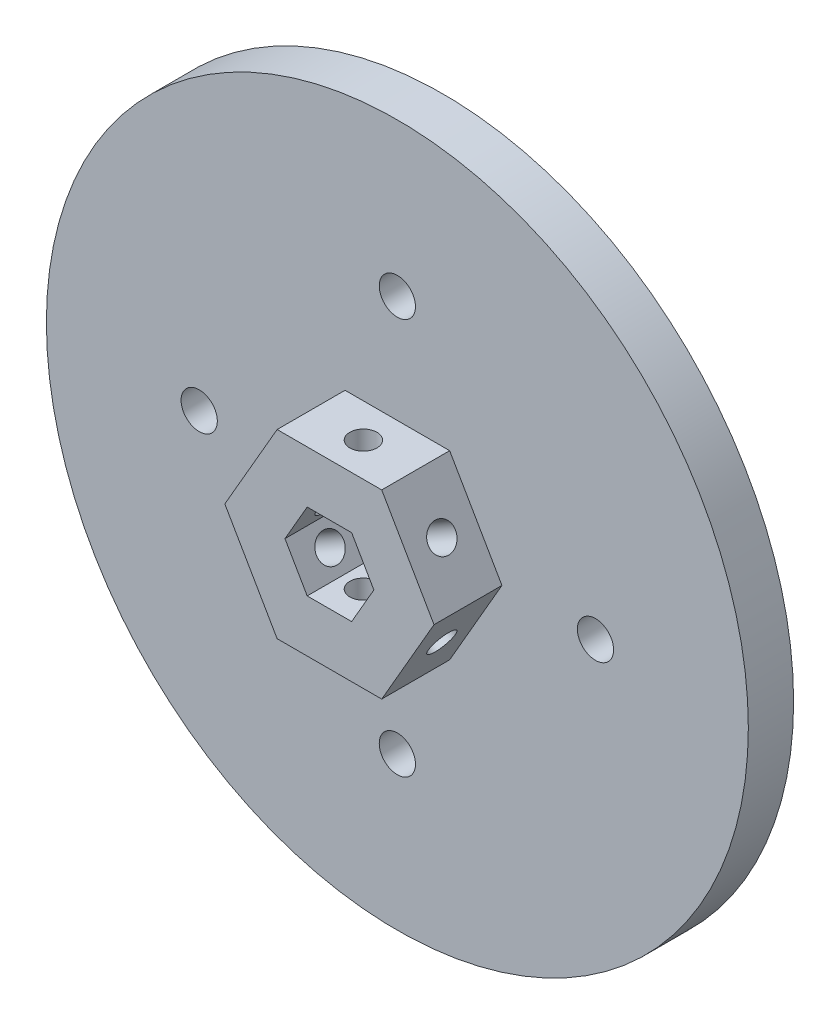
from build123d import *

# Parameters (mm, degrees)
SZKIC1_R                    = 31
DODANIE_WYCI_GNI_CIE1_DEPTH = 4
DODANIE_WYCI_GNI_CIE2_DEPTH = 6
SZKIC3_R                    = 1.2
WYTNIJ_WYCI_GNI_CIE1_DEPTH  = 51.813384064
SZYK_KO_OWY1_COUNT          = 3
SZKIC4_R                    = 1.6
WYTNIJ_WYCI_GNI_CIE2_DEPTH  = 6
WYTNIJ_WYCI_GNI_CIE3_DEPTH  = 45.24929378


with BuildPart() as part:
    # Szkic1 → Dodanie-wyciągnięcie1 (new body)
    with BuildSketch(Plane.XY):
        Circle(SZKIC1_R)
    extrude(amount=DODANIE_WYCI_GNI_CIE1_DEPTH)

    # Szkic2 → Dodanie-wyciągnięcie2 (add)
    with BuildSketch(Plane.XY.offset(4)):
        Polygon((4.618802154, 8), (-4.618802154, 8), (-9.237604307, 0), (-4.618802154, -8), (4.618802154, -8), (9.237604307, 0), align=None)
        Polygon((1.962990915, 3.4), (-1.962990915, 3.4), (-3.92598183, 0), (-1.962990915, -3.4), (1.962990915, -3.4), (3.92598183, 0), align=None, mode=Mode.SUBTRACT)
    extrude(amount=DODANIE_WYCI_GNI_CIE2_DEPTH)

    # Szkic3 → Wytnij-wyciągnięcie1 (cut, through all)
    with BuildSketch(Plane(origin=(0, 8, 0), x_dir=(1, 0, 0), z_dir=(0, 1, 0))):
        with Locations(Location((0, -7, 0), (0, 0, 180))):
            Circle(SZKIC3_R)
    wytnij_wyci_gni_cie1 = extrude(amount=-WYTNIJ_WYCI_GNI_CIE1_DEPTH, mode=Mode.SUBTRACT)

    # Szyk kołowy1: Wytnij-wyciągnięcie1 ×3 about axis
    szyk_ko_owy1_axis = Axis((0, 0, 4), (0, 0, 1))
    for i in range(1, SZYK_KO_OWY1_COUNT):
        add(wytnij_wyci_gni_cie1.rotate(szyk_ko_owy1_axis, i * 360 / SZYK_KO_OWY1_COUNT), mode=Mode.SUBTRACT)

    # Szkic4 → Wytnij-wyciągnięcie2 (cut)
    with BuildSketch(Plane.XY.offset(4)):
        with Locations((0, 17.5)):
            Circle(SZKIC4_R)
        with Locations((17.5, 0)):
            Circle(SZKIC4_R)
        with Locations((0, -17.5)):
            Circle(SZKIC4_R)
        with Locations((-17.5, 0)):
            Circle(SZKIC4_R)
    extrude(amount=-WYTNIJ_WYCI_GNI_CIE2_DEPTH, mode=Mode.SUBTRACT)

    # Szkic5 → Wytnij-wyciągnięcie3 (cut, through all)
    with BuildSketch(Plane.XY.offset(4)):
        Polygon((3.92598183, 0), (1.962990915, 3.4), (-1.962990915, 3.4), (-3.92598183, 0), (-1.962990915, -3.4), (1.962990915, -3.4), align=None)
    extrude(amount=-WYTNIJ_WYCI_GNI_CIE3_DEPTH, mode=Mode.SUBTRACT)


solid = part.part
